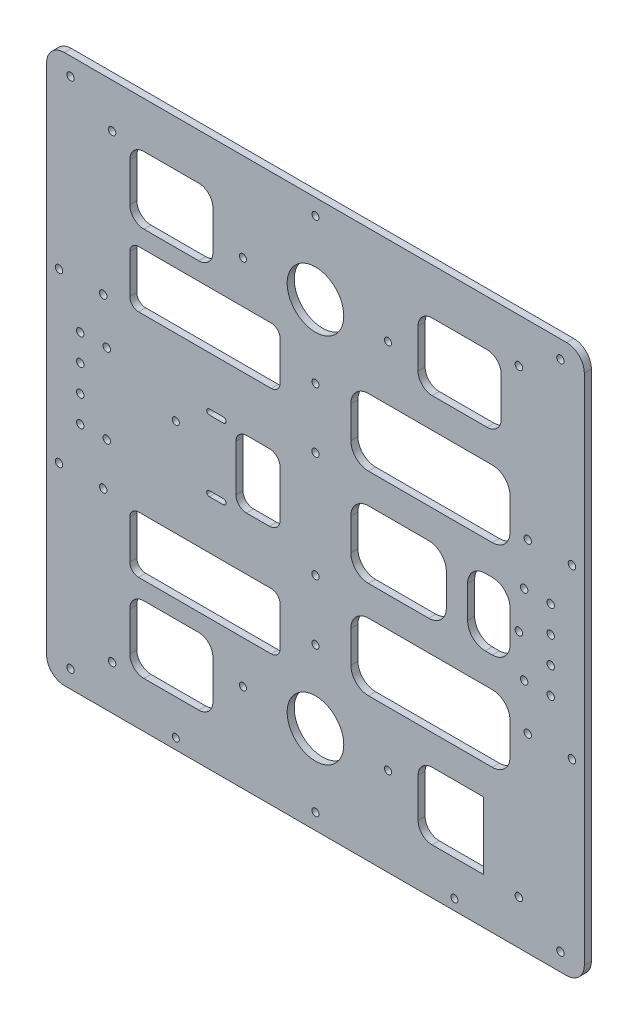
from build123d import *

# Parameters (mm, degrees)
SKETCH_1_R          = 2.1
SKETCH_1_R_2        = 2
SKETCH_1_R_3        = 16
EXTRUDE_1_DEPTH     = 4
CUT_EXTRUDE_1_REACH = 219.129
SKETCH_2_R          = 2.1
CUT_EXTRUDE_2_REACH = 219.129
SKETCH_3_R          = 2.1
CUT_EXTRUDE_3_REACH = 219.129
SKETCH_4_R          = 2.1
SKETCH_5_W          = 9.074439696
SKETCH_5_H          = 39.429402793
SKETCH_5_W_2        = 9.116595703
SKETCH_5_H_2        = 38.060432974
EXTRUDE_2_DEPTH     = 4
FILLET_1_R          = 8
SKETCH_6_W          = 8.766607102
SKETCH_6_H          = 39.413082466
SKETCH_6_W_2        = 8
EXTRUDE_3_DEPTH     = 4
FILLET_2_R          = 8
SKETCH_8_W          = 16.411626396
SKETCH_8_H          = 15.682220778
SKETCH_8_W_2        = 10.941084264
SKETCH_8_H_2        = 10.211678646
SKETCH_8_W_3        = 13.07641526
SKETCH_8_H_3        = 17.165917396
SKETCH_8_W_4        = 15.501833168
SKETCH_8_H_4        = 13.086487615
EXTRUDE_4_DEPTH     = 4
CUT_EXTRUDE_4_REACH = 219.129
SKETCH_7_R          = 2
SKETCH_9_R          = 2
CUT_EXTRUDE_5_DEPTH = 10
SKETCH_10_W         = 12
SKETCH_10_H         = 38
EXTRUDE_5_DEPTH     = 4
FILLET_3_R          = 10
SKETCH_12_W         = 10.901521511
SKETCH_12_H         = 38
EXTRUDE_6_DEPTH     = 4


with BuildPart() as part:
    # 草图1 → 凸台-拉伸1 (new body)
    with BuildSketch(Plane(origin=(0, 0, 0), x_dir=(-1, 0, 0), z_dir=(0, 0, -1))):
        with BuildLine():
            Line((142, 155), (-142, 155))
            ThreePointArc((-142, 155), (-149.071067812, 152.071067812), (-152, 145))
            Line((-152, 145), (-152, -145))
            ThreePointArc((-152, -145), (-149.071067812, -152.071067812), (-142, -155))
            Line((-142, -155), (142, -155))
            ThreePointArc((142, -155), (149.071067812, -152.071067812), (152, -145))
            Line((152, -145), (152, 145))
            ThreePointArc((152, 145), (149.071067812, 152.071067812), (142, 155))
        make_face()
        with Locations(Location((0, 63.987806691, 0), (0, 0, 180))):
            Circle(SKETCH_1_R, mode=Mode.SUBTRACT)
        with Locations(Location((0, 146.012193309, 0), (0, 0, 180))):
            Circle(SKETCH_1_R, mode=Mode.SUBTRACT)
        with Locations(Location((0, -146.012193309, 0), (0, 0, 180))):
            Circle(SKETCH_1_R, mode=Mode.SUBTRACT)
        with Locations(Location((41, 105, 0), (0, 0, 180))):
            Circle(SKETCH_1_R_2, mode=Mode.SUBTRACT)
        with Locations(Location((0, -105, 0), (0, 0, 180))):
            Circle(SKETCH_1_R_3, mode=Mode.SUBTRACT)
        with Locations(Location((0, 105, 0), (0, 0, 180))):
            Circle(SKETCH_1_R_3, mode=Mode.SUBTRACT)
        with Locations(Location((0, -63.987806691, 0), (0, 0, 180))):
            Circle(SKETCH_1_R, mode=Mode.SUBTRACT)
        with Locations(Location((-41, -105, 0), (0, 0, 180))):
            Circle(SKETCH_1_R_2, mode=Mode.SUBTRACT)
        with Locations(Location((41, -105, 0), (0, 0, 180))):
            Circle(SKETCH_1_R_2, mode=Mode.SUBTRACT)
        with Locations(Location((-41, 105, 0), (0, 0, 180))):
            Circle(SKETCH_1_R_2, mode=Mode.SUBTRACT)
        with Locations(Location((120, 47.5, 0), (0, 0, 180))):
            Circle(SKETCH_1_R, mode=Mode.SUBTRACT)
        with Locations(Location((-145, 47.5, 0), (0, 0, 180))):
            Circle(SKETCH_1_R, mode=Mode.SUBTRACT)
        with Locations(Location((-145, -47.5, 0), (0, 0, 180))):
            Circle(SKETCH_1_R, mode=Mode.SUBTRACT)
        with Locations(Location((-120, -47.5, 0), (0, 0, 180))):
            Circle(SKETCH_1_R, mode=Mode.SUBTRACT)
        with Locations(Location((120, -47.5, 0), (0, 0, 180))):
            Circle(SKETCH_1_R, mode=Mode.SUBTRACT)
        with Locations(Location((145, -47.5, 0), (0, 0, 180))):
            Circle(SKETCH_1_R, mode=Mode.SUBTRACT)
        with Locations(Location((-115, 0, 0), (0, 0, 180))):
            Circle(SKETCH_1_R, mode=Mode.SUBTRACT)
        with Locations(Location((145, 47.5, 0), (0, 0, 180))):
            Circle(SKETCH_1_R, mode=Mode.SUBTRACT)
        with Locations(Location((0, -30, 0), (0, 0, 180))):
            Circle(SKETCH_1_R, mode=Mode.SUBTRACT)
        with Locations(Location((0, 30, 0), (0, 0, 180))):
            Circle(SKETCH_1_R, mode=Mode.SUBTRACT)
        with Locations(Location((115, 130, 0), (0, 0, 180))):
            Circle(SKETCH_1_R, mode=Mode.SUBTRACT)
        with Locations(Location((115, -130, 0), (0, 0, 180))):
            Circle(SKETCH_1_R, mode=Mode.SUBTRACT)
        with Locations(Location((-115, -130, 0), (0, 0, 180))):
            Circle(SKETCH_1_R, mode=Mode.SUBTRACT)
        with Locations(Location((-115, 130, 0), (0, 0, 180))):
            Circle(SKETCH_1_R, mode=Mode.SUBTRACT)
        with Locations(Location((-120, 47.5, 0), (0, 0, 180))):
            Circle(SKETCH_1_R, mode=Mode.SUBTRACT)
        with BuildLine():
            Line((60, -21.5), (52, -21.5))
            ThreePointArc((52, -21.5), (50.5, -20), (52, -18.5))
            Line((52, -18.5), (60, -18.5))
            ThreePointArc((60, -18.5), (61.5, -20), (60, -21.5))
        make_face(mode=Mode.SUBTRACT)
        with BuildLine():
            Line((60, 18.5), (52, 18.5))
            ThreePointArc((52, 18.5), (50.5, 20), (52, 21.5))
            Line((52, 21.5), (60, 21.5))
            ThreePointArc((60, 21.5), (61.5, 20), (60, 18.5))
        make_face(mode=Mode.SUBTRACT)
        with BuildLine():
            Line((-100, -36), (-30, -36))
            ThreePointArc((-30, -36), (-22.928932188, -38.928932188), (-20, -46))
            Line((-20, -46), (-20, -64))
            ThreePointArc((-20, -64), (-22.928932188, -71.071067812), (-30, -74))
            Line((-30, -74), (-100, -74))
            ThreePointArc((-100, -74), (-107.071067812, -71.071067812), (-110, -64))
            Line((-110, -64), (-110, -46))
            ThreePointArc((-110, -46), (-107.071067812, -38.928932188), (-100, -36))
        make_face(mode=Mode.SUBTRACT)
        with BuildLine():
            Line((-100, 19), (-30, 19))
            ThreePointArc((-30, 19), (-22.928932188, 16.071067812), (-20, 9))
            Line((-20, 9), (-20, -9))
            ThreePointArc((-20, -9), (-22.928932188, -16.071067812), (-30, -19))
            Line((-30, -19), (-100, -19))
            ThreePointArc((-100, -19), (-107.071067812, -16.071067812), (-110, -9))
            Line((-110, -9), (-110, 9))
            ThreePointArc((-110, 9), (-107.071067812, 16.071067812), (-100, 19))
        make_face(mode=Mode.SUBTRACT)
        with BuildLine():
            Line((-100, 74), (-30, 74))
            ThreePointArc((-30, 74), (-22.928932188, 71.071067812), (-20, 64))
            Line((-20, 64), (-20, 46))
            ThreePointArc((-20, 46), (-22.928932188, 38.928932188), (-30, 36))
            Line((-30, 36), (-100, 36))
            ThreePointArc((-100, 36), (-107.071067812, 38.928932188), (-110, 46))
            Line((-110, 46), (-110, 64))
            ThreePointArc((-110, 64), (-107.071067812, 71.071067812), (-100, 74))
        make_face(mode=Mode.SUBTRACT)
        with BuildLine():
            Line((25, 81), (100, 81))
            ThreePointArc((100, 81), (103.535533906, 79.535533906), (105, 76))
            Line((105, 76), (105, 54))
            ThreePointArc((105, 54), (103.535533906, 50.464466094), (100, 49))
            Line((100, 49), (25, 49))
            ThreePointArc((25, 49), (21.464466094, 50.464466094), (20, 54))
            Line((20, 54), (20, 76))
            ThreePointArc((20, 76), (21.464466094, 79.535533906), (25, 81))
        make_face(mode=Mode.SUBTRACT)
        with BuildLine():
            Line((25, -49), (100, -49))
            ThreePointArc((100, -49), (103.535533906, -50.464466094), (105, -54))
            Line((105, -54), (105, -76))
            ThreePointArc((105, -76), (103.535533906, -79.535533906), (100, -81))
            Line((100, -81), (25, -81))
            ThreePointArc((25, -81), (21.464466094, -79.535533906), (20, -76))
            Line((20, -76), (20, -54))
            ThreePointArc((20, -54), (21.464466094, -50.464466094), (25, -49))
        make_face(mode=Mode.SUBTRACT)
        with BuildLine():
            Line((-97, 129), (-58, 129))
            ThreePointArc((-58, 129), (-52.343145751, 126.656854249), (-50, 121))
            Line((-50, 121), (-50, 99))
            ThreePointArc((-50, 99), (-52.343145751, 93.343145751), (-58, 91))
            Line((-58, 91), (-97, 91))
            ThreePointArc((-97, 91), (-102.656854249, 93.343145751), (-105, 99))
            Line((-105, 99), (-105, 121))
            ThreePointArc((-105, 121), (-102.656854249, 126.656854249), (-97, 129))
        make_face(mode=Mode.SUBTRACT)
        with BuildLine():
            Line((97, 91), (58, 91))
            ThreePointArc((58, 91), (52.343145751, 93.343145751), (50, 99))
            Line((50, 99), (50, 121))
            ThreePointArc((50, 121), (52.343145751, 126.656854249), (58, 129))
            Line((58, 129), (97, 129))
            ThreePointArc((97, 129), (102.656854249, 126.656854249), (105, 121))
            Line((105, 121), (105, 99))
            ThreePointArc((105, 99), (102.656854249, 93.343145751), (97, 91))
        make_face(mode=Mode.SUBTRACT)
        with BuildLine():
            Line((39, -19), (26, -19))
            ThreePointArc((26, -19), (21.757359313, -17.242640687), (20, -13))
            Line((20, -13), (20, 13))
            ThreePointArc((20, 13), (21.757359313, 17.242640687), (26, 19))
            Line((26, 19), (39, 19))
            ThreePointArc((39, 19), (43.242640687, 17.242640687), (45, 13))
            Line((45, 13), (45, -13))
            ThreePointArc((45, -13), (43.242640687, -17.242640687), (39, -19))
        make_face(mode=Mode.SUBTRACT)
        with BuildLine():
            Line((97, -129), (58, -129))
            ThreePointArc((58, -129), (52.343145751, -126.656854249), (50, -121))
            Line((50, -121), (50, -99))
            ThreePointArc((50, -99), (52.343145751, -93.343145751), (58, -91))
            Line((58, -91), (97, -91))
            ThreePointArc((97, -91), (102.656854249, -93.343145751), (105, -99))
            Line((105, -99), (105, -121))
            ThreePointArc((105, -121), (102.656854249, -126.656854249), (97, -129))
        make_face(mode=Mode.SUBTRACT)
        with BuildLine():
            Line((-97, -91), (-58, -91))
            ThreePointArc((-58, -91), (-52.343145751, -93.343145751), (-50, -99))
            Line((-50, -99), (-50, -121))
            ThreePointArc((-50, -121), (-52.343145751, -126.656854249), (-58, -129))
            Line((-58, -129), (-97, -129))
            ThreePointArc((-97, -129), (-102.656854249, -126.656854249), (-105, -121))
            Line((-105, -121), (-105, -99))
            ThreePointArc((-105, -99), (-102.656854249, -93.343145751), (-97, -91))
        make_face(mode=Mode.SUBTRACT)
    extrude(amount=-EXTRUDE_1_DEPTH)

    # 草图2 → 切除-拉伸1 (cut, up to next)
    with BuildSketch(Plane(origin=(0, 0, 0), x_dir=(-1, 0, 0), z_dir=(0, 0, -1)), mode=Mode.PRIVATE) as cut_extrude_1_sk1:
        with Locations((-138.5, 145)):
            Circle(SKETCH_2_R)
    cut_extrude_1_tool1 = extrude(cut_extrude_1_sk1.sketch, amount=-CUT_EXTRUDE_1_REACH, mode=Mode.PRIVATE) & part.part
    # 草图2 → 切除-拉伸1 (cut, up to next)
    with BuildSketch(Plane(origin=(0, 0, 0), x_dir=(-1, 0, 0), z_dir=(0, 0, -1)), mode=Mode.PRIVATE) as cut_extrude_1_sk2:
        with Locations((138.5, 145)):
            Circle(SKETCH_2_R)
    cut_extrude_1_tool2 = extrude(cut_extrude_1_sk2.sketch, amount=-CUT_EXTRUDE_1_REACH, mode=Mode.PRIVATE) & part.part
    # 草图2 → 切除-拉伸1 (cut, up to next)
    with BuildSketch(Plane(origin=(0, 0, 0), x_dir=(-1, 0, 0), z_dir=(0, 0, -1)), mode=Mode.PRIVATE) as cut_extrude_1_sk3:
        with Locations((138.5, -145)):
            Circle(SKETCH_2_R)
    cut_extrude_1_tool3 = extrude(cut_extrude_1_sk3.sketch, amount=-CUT_EXTRUDE_1_REACH, mode=Mode.PRIVATE) & part.part
    # 草图2 → 切除-拉伸1 (cut, up to next)
    with BuildSketch(Plane(origin=(0, 0, 0), x_dir=(-1, 0, 0), z_dir=(0, 0, -1)), mode=Mode.PRIVATE) as cut_extrude_1_sk4:
        with Locations((-138.5, -145)):
            Circle(SKETCH_2_R)
    cut_extrude_1_tool4 = extrude(cut_extrude_1_sk4.sketch, amount=-CUT_EXTRUDE_1_REACH, mode=Mode.PRIVATE) & part.part
    add(cut_extrude_1_tool1.solids().sort_by_distance((138.5, 145, 0))[0], mode=Mode.SUBTRACT)
    add(cut_extrude_1_tool2.solids().sort_by_distance((-138.5, 145, 0))[0], mode=Mode.SUBTRACT)
    add(cut_extrude_1_tool3.solids().sort_by_distance((-138.5, -145, 0))[0], mode=Mode.SUBTRACT)
    add(cut_extrude_1_tool4.solids().sort_by_distance((138.5, -145, 0))[0], mode=Mode.SUBTRACT)

    # 草图3 → 切除-拉伸2 (cut, up to next)
    with BuildSketch(Plane(origin=(0, 0, 0), x_dir=(-1, 0, 0), z_dir=(0, 0, -1)), mode=Mode.PRIVATE) as cut_extrude_2_sk1:
        with Locations((133, 7.5)):
            Circle(SKETCH_3_R)
    cut_extrude_2_tool1 = extrude(cut_extrude_2_sk1.sketch, amount=-CUT_EXTRUDE_2_REACH, mode=Mode.PRIVATE) & part.part
    # 草图3 → 切除-拉伸2 (cut, up to next)
    with BuildSketch(Plane(origin=(0, 0, 0), x_dir=(-1, 0, 0), z_dir=(0, 0, -1)), mode=Mode.PRIVATE) as cut_extrude_2_sk2:
        with Locations((133, -7.5)):
            Circle(SKETCH_3_R)
    cut_extrude_2_tool2 = extrude(cut_extrude_2_sk2.sketch, amount=-CUT_EXTRUDE_2_REACH, mode=Mode.PRIVATE) & part.part
    # 草图3 → 切除-拉伸2 (cut, up to next)
    with BuildSketch(Plane(origin=(0, 0, 0), x_dir=(-1, 0, 0), z_dir=(0, 0, -1)), mode=Mode.PRIVATE) as cut_extrude_2_sk3:
        with Locations((133, -22.5)):
            Circle(SKETCH_3_R)
    cut_extrude_2_tool3 = extrude(cut_extrude_2_sk3.sketch, amount=-CUT_EXTRUDE_2_REACH, mode=Mode.PRIVATE) & part.part
    # 草图3 → 切除-拉伸2 (cut, up to next)
    with BuildSketch(Plane(origin=(0, 0, 0), x_dir=(-1, 0, 0), z_dir=(0, 0, -1)), mode=Mode.PRIVATE) as cut_extrude_2_sk4:
        with Locations((133, 22.5)):
            Circle(SKETCH_3_R)
    cut_extrude_2_tool4 = extrude(cut_extrude_2_sk4.sketch, amount=-CUT_EXTRUDE_2_REACH, mode=Mode.PRIVATE) & part.part
    cut_extrude_2_1 = cut_extrude_2_tool1.solids().sort_by_distance((-133, 7.5, 0))[0]
    add(cut_extrude_2_1, mode=Mode.SUBTRACT)
    cut_extrude_2_2 = cut_extrude_2_tool2.solids().sort_by_distance((-133, -7.5, 0))[0]
    add(cut_extrude_2_2, mode=Mode.SUBTRACT)
    cut_extrude_2_3 = cut_extrude_2_tool3.solids().sort_by_distance((-133, -22.5, 0))[0]
    add(cut_extrude_2_3, mode=Mode.SUBTRACT)
    cut_extrude_2_4 = cut_extrude_2_tool4.solids().sort_by_distance((-133, 22.5, 0))[0]
    add(cut_extrude_2_4, mode=Mode.SUBTRACT)
    cut_extrude_2 = cut_extrude_2_1 + cut_extrude_2_2 + cut_extrude_2_3 + cut_extrude_2_4  # 切除-拉伸2 as one shape, for the pattern or mirror that repeats it

    # 镜向1: 切除-拉伸2 across plane
    add(cut_extrude_2.mirror(Plane.ZY), mode=Mode.SUBTRACT)

    # 草图4 → 切除-拉伸3 (cut, up to next)
    with BuildSketch(Plane(origin=(0, 0, 0), x_dir=(-1, 0, 0), z_dir=(0, 0, -1)), mode=Mode.PRIVATE) as cut_extrude_3_sk1:
        with Locations((-118, 22.5)):
            Circle(SKETCH_4_R)
    cut_extrude_3_tool1 = extrude(cut_extrude_3_sk1.sketch, amount=-CUT_EXTRUDE_3_REACH, mode=Mode.PRIVATE) & part.part
    # 草图4 → 切除-拉伸3 (cut, up to next)
    with BuildSketch(Plane(origin=(0, 0, 0), x_dir=(-1, 0, 0), z_dir=(0, 0, -1)), mode=Mode.PRIVATE) as cut_extrude_3_sk2:
        with Locations((-118, -22.5)):
            Circle(SKETCH_4_R)
    cut_extrude_3_tool2 = extrude(cut_extrude_3_sk2.sketch, amount=-CUT_EXTRUDE_3_REACH, mode=Mode.PRIVATE) & part.part
    cut_extrude_3_1 = cut_extrude_3_tool1.solids().sort_by_distance((118, 22.5, 0))[0]
    add(cut_extrude_3_1, mode=Mode.SUBTRACT)
    cut_extrude_3_2 = cut_extrude_3_tool2.solids().sort_by_distance((118, -22.5, 0))[0]
    add(cut_extrude_3_2, mode=Mode.SUBTRACT)
    cut_extrude_3 = cut_extrude_3_1 + cut_extrude_3_2  # 切除-拉伸3 as one shape, for the pattern or mirror that repeats it

    # 镜向2: 切除-拉伸3 across plane
    add(cut_extrude_3.mirror(Plane.ZY), mode=Mode.SUBTRACT)

    # 草图5 → 凸台-拉伸2 (add)
    with BuildSketch(Plane(origin=(0, 0, 0), x_dir=(-1, 0, 0), z_dir=(0, 0, -1))):
        with Locations((-53.462780152, 109.285298603)):
            Rectangle(SKETCH_5_W, SKETCH_5_H)
        with Locations((53.441702149, 109.969783513)):
            Rectangle(SKETCH_5_W_2, SKETCH_5_H_2)
    extrude(amount=-EXTRUDE_2_DEPTH)

    # 圆角1
    fillet_1_edges = [part.edges().sort_by_distance(p)[0] for p in [
        (58, 129, 2),
        (58, 91, 2),
        (-58, 91, 2),
        (-58, 129, 2),
    ]]
    fillet(fillet_1_edges, radius=FILLET_1_R)

    # 草图6 → 凸台-拉伸3 (add)
    with BuildSketch(Plane(origin=(0, 0, 0), x_dir=(-1, 0, 0), z_dir=(0, 0, -1))):
        with Locations((-53.616696449, -110.706541233)):
            Rectangle(SKETCH_6_W, SKETCH_6_H)
        with Locations((54, -110.706541233)):
            Rectangle(SKETCH_6_W_2, SKETCH_6_H)
    extrude(amount=-EXTRUDE_3_DEPTH)

    # 圆角2
    fillet_2_edges = [part.edges().sort_by_distance(p)[0] for p in [
        (-58, -129, 2),
        (-58, -91, 2),
        (58, -91, 2),
        (58, -129, 2),
    ]]
    fillet(fillet_2_edges, radius=FILLET_2_R)

    # 草图8 → 凸台-拉伸4 (add)
    with BuildSketch(Plane(origin=(0, 0, 0), x_dir=(-1, 0, 0), z_dir=(0, 0, -1))):
        with Locations((1.805551979, 143.719584865)):
            Rectangle(SKETCH_8_W, SKETCH_8_H)
        with Locations((-0.929719087, 62.208507098)):
            Rectangle(SKETCH_8_W_2, SKETCH_8_H_2)
        with Locations((0.137946411, -64.971652375)):
            Rectangle(SKETCH_8_W_3, SKETCH_8_H_3)
        with Locations((-1.074762543, -145.291316458)):
            Rectangle(SKETCH_8_W_4, SKETCH_8_H_4)
    extrude(amount=-EXTRUDE_4_DEPTH)

    # 草图7 → 切除-拉伸4 (cut, up to next)
    with BuildSketch(Plane(origin=(0, 0, 0), x_dir=(-1, 0, 0), z_dir=(0, 0, -1)), mode=Mode.PRIVATE) as cut_extrude_4_sk1:
        with Locations((0, 146)):
            Circle(SKETCH_7_R)
    cut_extrude_4_tool1 = extrude(cut_extrude_4_sk1.sketch, amount=-CUT_EXTRUDE_4_REACH, mode=Mode.PRIVATE) & part.part
    # 草图7 → 切除-拉伸4 (cut, up to next)
    with BuildSketch(Plane(origin=(0, 0, 0), x_dir=(-1, 0, 0), z_dir=(0, 0, -1)), mode=Mode.PRIVATE) as cut_extrude_4_sk2:
        with Locations((0, 64)):
            Circle(SKETCH_7_R)
    cut_extrude_4_tool2 = extrude(cut_extrude_4_sk2.sketch, amount=-CUT_EXTRUDE_4_REACH, mode=Mode.PRIVATE) & part.part
    # 草图7 → 切除-拉伸4 (cut, up to next)
    with BuildSketch(Plane(origin=(0, 0, 0), x_dir=(-1, 0, 0), z_dir=(0, 0, -1)), mode=Mode.PRIVATE) as cut_extrude_4_sk3:
        with Locations((0, -64)):
            Circle(SKETCH_7_R)
    cut_extrude_4_tool3 = extrude(cut_extrude_4_sk3.sketch, amount=-CUT_EXTRUDE_4_REACH, mode=Mode.PRIVATE) & part.part
    # 草图7 → 切除-拉伸4 (cut, up to next)
    with BuildSketch(Plane(origin=(0, 0, 0), x_dir=(-1, 0, 0), z_dir=(0, 0, -1)), mode=Mode.PRIVATE) as cut_extrude_4_sk4:
        with Locations((0, -146)):
            Circle(SKETCH_7_R)
    cut_extrude_4_tool4 = extrude(cut_extrude_4_sk4.sketch, amount=-CUT_EXTRUDE_4_REACH, mode=Mode.PRIVATE) & part.part
    add(cut_extrude_4_tool1.solids().sort_by_distance((0, 146, 0))[0], mode=Mode.SUBTRACT)
    add(cut_extrude_4_tool2.solids().sort_by_distance((0, 64, 0))[0], mode=Mode.SUBTRACT)
    add(cut_extrude_4_tool3.solids().sort_by_distance((0, -64, 0))[0], mode=Mode.SUBTRACT)
    add(cut_extrude_4_tool4.solids().sort_by_distance((0, -146, 0))[0], mode=Mode.SUBTRACT)

    # 草图9 → 切除-拉伸5 (cut)
    with BuildSketch(Plane(origin=(0, 0, 0), x_dir=(-1, 0, 0), z_dir=(0, 0, -1))):
        with Locations((78.957231568, -149)):
            Circle(SKETCH_9_R)
        with Locations((78.957231568, 6)):
            Circle(SKETCH_9_R)
        with Locations((-78.542768432, -149)):
            Circle(SKETCH_9_R)
    extrude(amount=-CUT_EXTRUDE_5_DEPTH, mode=Mode.SUBTRACT)

    # 草图10 → 凸台-拉伸5 (add)
    with BuildSketch(Plane(origin=(0, 0, 0), x_dir=(-1, 0, 0), z_dir=(0, 0, -1))):
        with Locations((-80, 0)):
            Rectangle(SKETCH_10_W, SKETCH_10_H)
    extrude(amount=-EXTRUDE_5_DEPTH)

    # 圆角3
    fillet_3_edges = [part.edges().sort_by_distance(p)[0] for p in [
        (86, 19, 2),
        (74, 19, 2),
        (74, -19, 2),
        (86, -19, 2),
    ]]
    fillet(fillet_3_edges, radius=FILLET_3_R)

    # 草图12 → 凸台-拉伸6 (add)
    with BuildSketch(Plane(origin=(0, 0, 0), x_dir=(-1, 0, 0), z_dir=(0, 0, -1))):
        with Locations((-100.450760755, -110)):
            Rectangle(SKETCH_12_W, SKETCH_12_H)
    extrude(amount=-EXTRUDE_6_DEPTH)


solid = part.part
